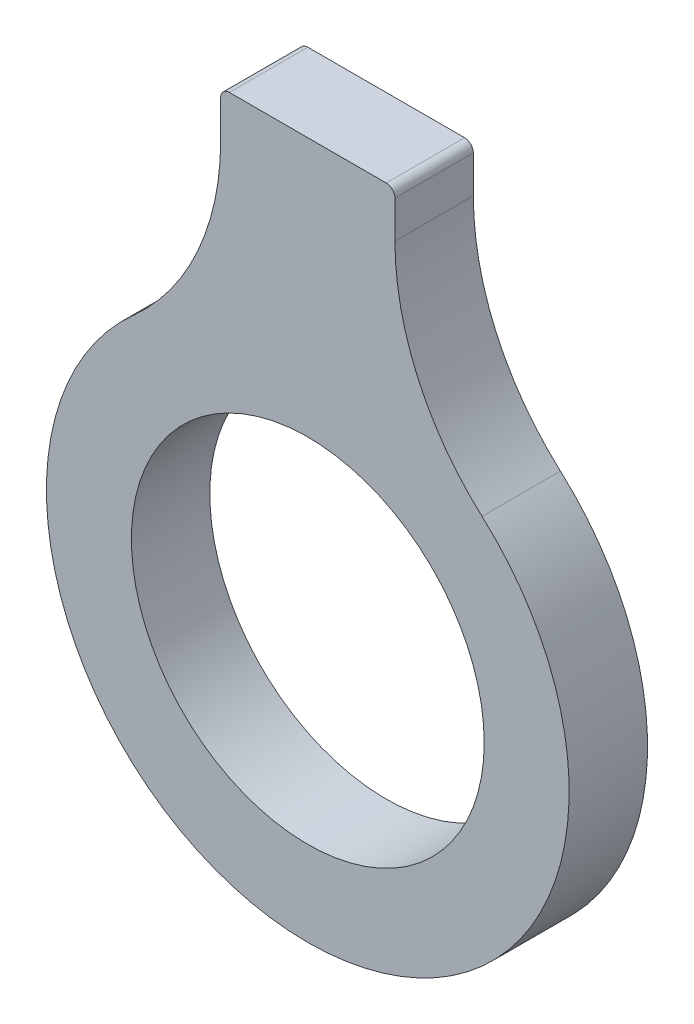
from build123d import *

# Parameters (mm, degrees)
EXTRUDE_1_DEPTH     = 1.8
SKETCH_2_R          = 4.05
CUT_EXTRUDE_1_DEPTH = 1.8


with BuildPart() as part:
    # 草图1 → 凸台-拉伸1 (new body)
    with BuildSketch(Plane.XY):
        with BuildLine():
            Line((-2, 8.94427191), (-2, 9.8))
            ThreePointArc((-2, 9.8), (-1.941421356, 9.941421356), (-1.8, 10))
            Line((-1.8, 10), (1.8, 10))
            ThreePointArc((1.8, 10), (1.941421356, 9.941421356), (2, 9.8))
            Line((2, 9.8), (2, 8.94427191))
            ThreePointArc((2, 8.94427191), (2.522774425, 6.494782167), (4, 4.472135955))
            ThreePointArc((4, 4.472135955), (0, -6), (-4, 4.472135955))
            ThreePointArc((-4, 4.472135955), (-2.522774425, 6.494782167), (-2, 8.94427191))
        make_face()
    extrude(amount=-EXTRUDE_1_DEPTH)

    # 草图2 → 切除-拉伸1 (cut)
    with BuildSketch(Plane.XY):
        Circle(SKETCH_2_R)
    extrude(amount=-CUT_EXTRUDE_1_DEPTH, mode=Mode.SUBTRACT)


solid = part.part
